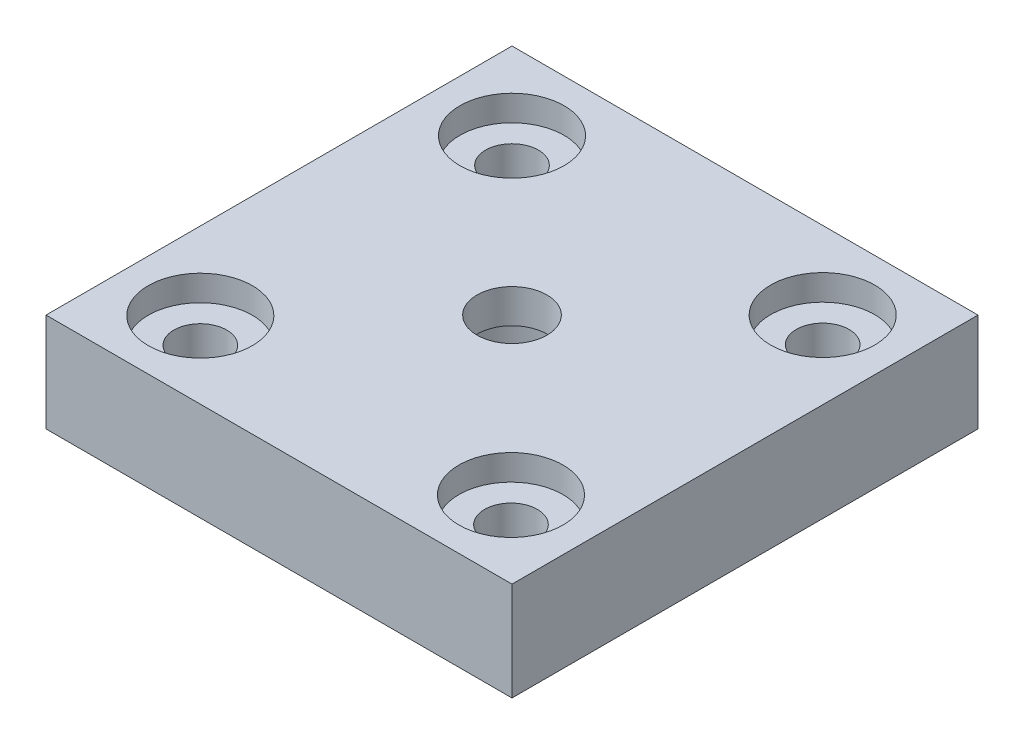
from build123d import *

# Parameters (mm, degrees)
SKETCH1_W                                           = 30
SKETCH1_H                                           = 30
MOUNT_BLOCK_DEPTH                                   = 6.35
LINEAR_STAGE_CBORE_FOR_M3_SBHCS1_D                  = 3.4
LINEAR_STAGE_CBORE_FOR_M3_SBHCS1_CBORE_D            = 6.7
LINEAR_STAGE_CBORE_FOR_M3_SBHCS1_CBORE_DEPTH        = 1.65
OPTICAL_POST_CBORE_FOR_8_SOCKET_HEAD_CA_D           = 4.4958
OPTICAL_POST_CBORE_FOR_8_SOCKET_HEAD_CA_CBORE_D     = 7.9375
OPTICAL_POST_CBORE_FOR_8_SOCKET_HEAD_CA_CBORE_DEPTH = 4.1656


with BuildPart() as part:
    # Sketch1 → Mount Block (new body)
    with BuildSketch(Plane(origin=(0, 0, 0), x_dir=(1, 0, 0), z_dir=(0, 1, 0))):
        Rectangle(SKETCH1_W, SKETCH1_H)
    extrude(amount=MOUNT_BLOCK_DEPTH)

    # Linear Stage CBORE for M3 SBHCS1 (through all)
    with Locations(Plane(origin=(0, 6.35, 0), x_dir=(1, 0, 0), z_dir=(0, 1, 0))):
        with Locations((-10, 10), (10, 10), (10, -10.066), (-10, -10.066)):
            CounterBoreHole(LINEAR_STAGE_CBORE_FOR_M3_SBHCS1_D / 2, LINEAR_STAGE_CBORE_FOR_M3_SBHCS1_CBORE_D / 2, LINEAR_STAGE_CBORE_FOR_M3_SBHCS1_CBORE_DEPTH)

    # Optical Post CBORE for #8 Socket Head Cap Screw (through all)
    with Locations(Plane(origin=(0, 0, 0), x_dir=(-1, 0, 0), z_dir=(0, -1, 0))):
        with Locations((0, 0)):
            CounterBoreHole(OPTICAL_POST_CBORE_FOR_8_SOCKET_HEAD_CA_D / 2, OPTICAL_POST_CBORE_FOR_8_SOCKET_HEAD_CA_CBORE_D / 2, OPTICAL_POST_CBORE_FOR_8_SOCKET_HEAD_CA_CBORE_DEPTH)


solid = part.part
